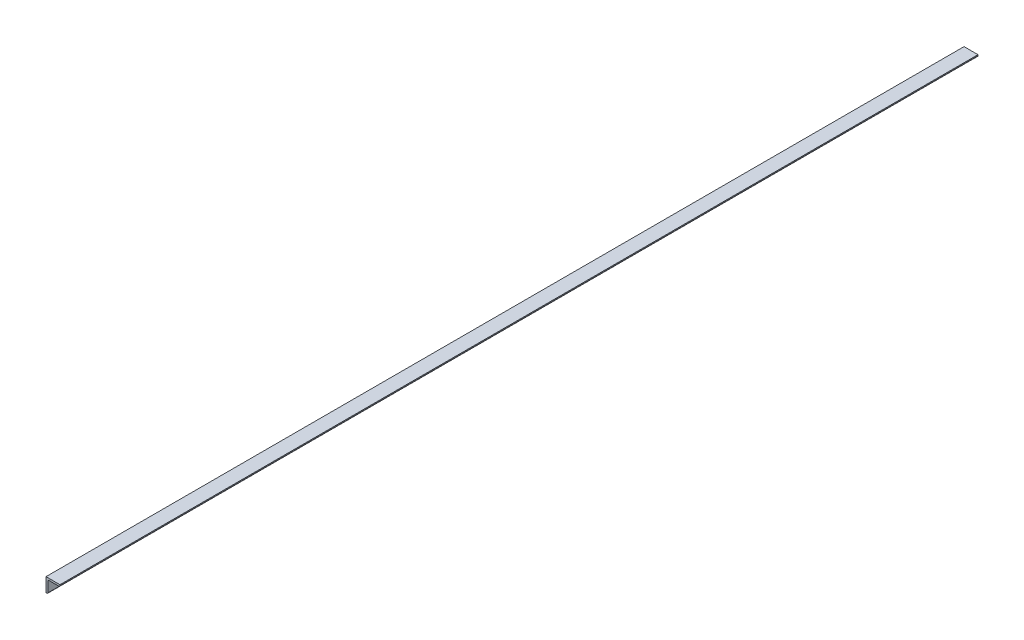
from build123d import *

# Parameters (mm, degrees)
BOSS_EXTRUDE1_DEPTH = 1975


with BuildPart() as part:
    # Sketch1 → Boss-Extrude1 (new body)
    with BuildSketch(Plane.XY):
        with BuildLine():
            Line((-8.625, 38.8125), (-38.625, 38.8125))
            Line((-38.625, 38.8125), (-38.625, 8.8125))
            Line((-38.625, 8.8125), (-36.625, 8.8125))
            ThreePointArc((-36.625, 8.8125), (-35.210786438, 9.398286438), (-34.625, 10.8125))
            Line((-34.625, 10.8125), (-34.625, 32.8125))
            ThreePointArc((-34.625, 32.8125), (-34.039213562, 34.226713562), (-32.625, 34.8125))
            Line((-32.625, 34.8125), (-10.625, 34.8125))
            ThreePointArc((-10.625, 34.8125), (-9.210786438, 35.398286438), (-8.625, 36.8125))
            Line((-8.625, 36.8125), (-8.625, 38.8125))
        make_face()
    extrude(amount=BOSS_EXTRUDE1_DEPTH)


solid = part.part
